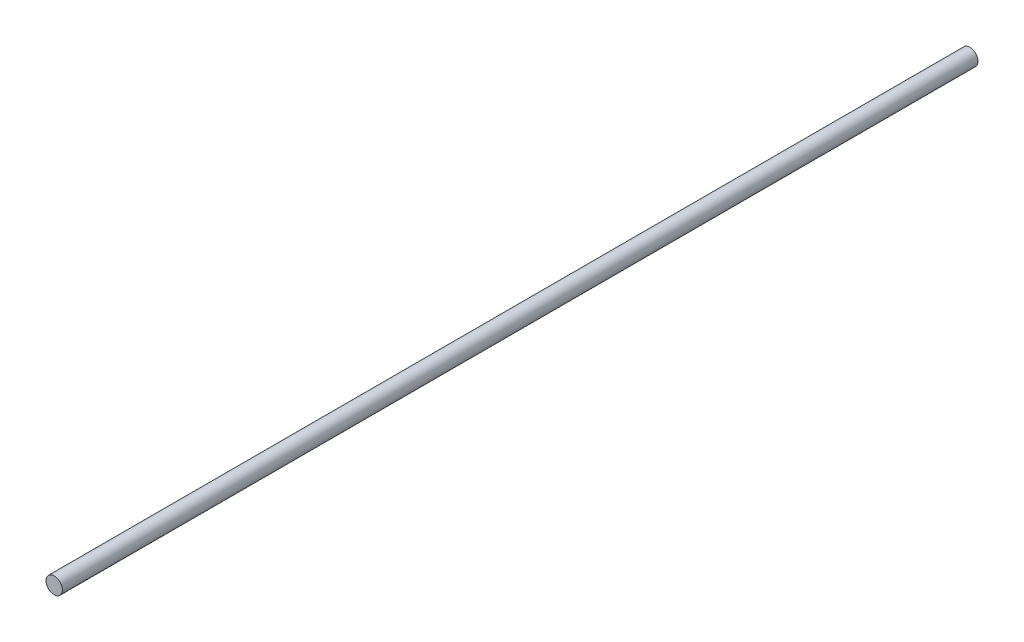
from build123d import *

# Parameters (mm, degrees)
SKETCH1_R           = 3.175
BOSS_EXTRUDE1_DEPTH = 355.6


with BuildPart() as part:
    # Sketch1 → Boss-Extrude1 (new body)
    with BuildSketch(Plane.XY):
        Circle(SKETCH1_R)
    extrude(amount=BOSS_EXTRUDE1_DEPTH)


solid = part.part
